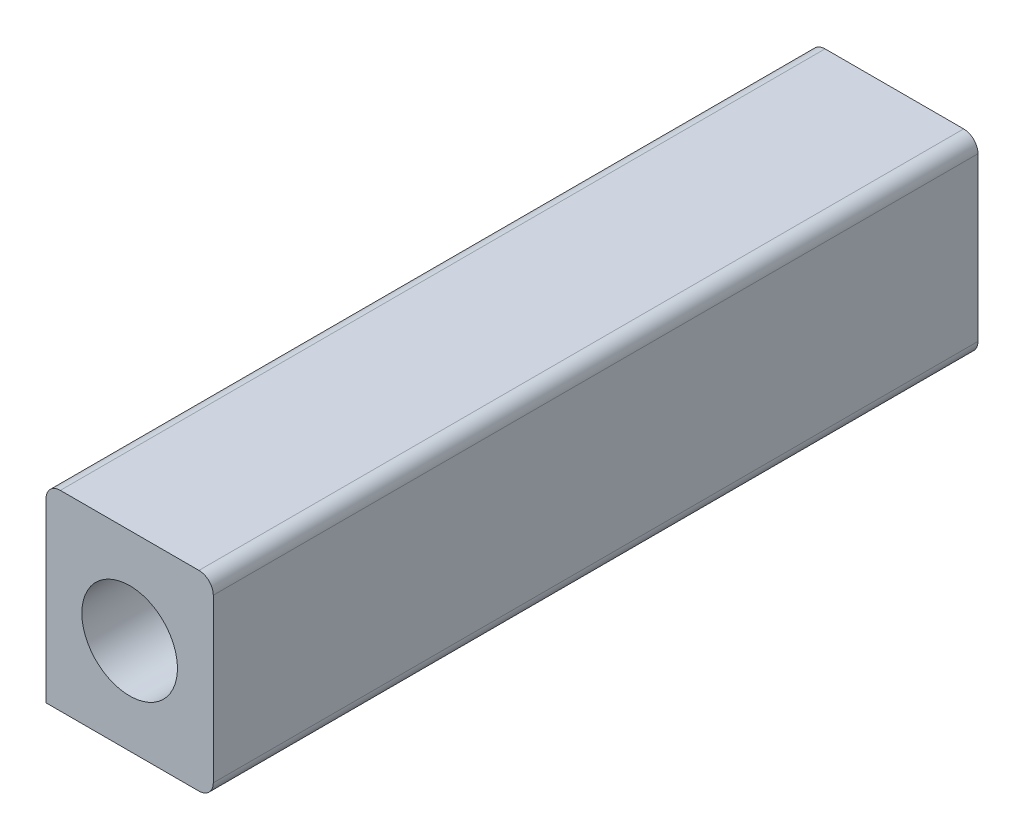
from build123d import *

# Parameters (mm, degrees)
SKETCH_8_W          = 70
SKETCH_8_H          = 80
EXTRUDE_1_DEPTH     = 320
SKETCH_9_R          = 20
CUT_EXTRUDE_1_DEPTH = 325.384031666
FILLET_1_R          = 6


with BuildPart() as part:
    # 草图8 → 凸台-拉伸1 (new body)
    with BuildSketch(Plane.XY):
        Rectangle(SKETCH_8_W, SKETCH_8_H)
    extrude(amount=EXTRUDE_1_DEPTH)

    # 草图9 → 切除-拉伸1 (cut, through all)
    with BuildSketch(Plane(origin=(0, 0, 0), x_dir=(-1, 0, 0), z_dir=(0, 0, -1))):
        Circle(SKETCH_9_R)
    extrude(amount=-CUT_EXTRUDE_1_DEPTH, mode=Mode.SUBTRACT)

    # 圆角1
    fillet_1_edges = [part.edges().sort_by_distance(p)[0] for p in [
        (-35, 40, 160),
        (35, 40, 160),
        (35, -40, 160),
    ]]
    fillet(fillet_1_edges, radius=FILLET_1_R)


solid = part.part
